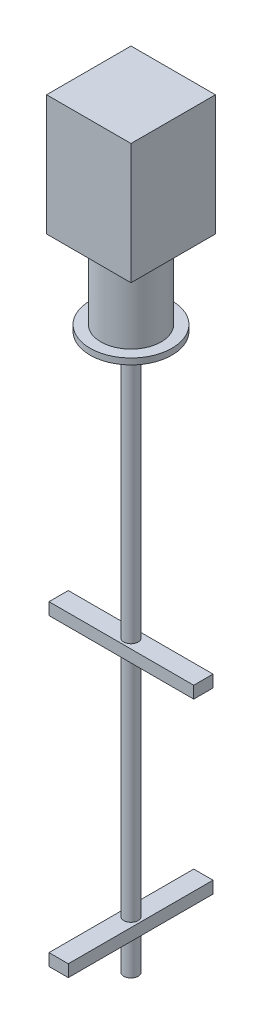
from build123d import *

# Parameters (mm, degrees)
SKETCH1_R           = 170
SKETCH1_R_2         = 100
BOSS_EXTRUDE1_DEPTH = 25
BOSS_EXTRUDE2_START = 25
SKETCH2_R           = 125
BOSS_EXTRUDE2_DEPTH = 325
BOSS_EXTRUDE3_START = 350
SKETCH3_W           = 350
SKETCH3_H           = 350
BOSS_EXTRUDE3_DEPTH = 500
SKETCH4_R           = 30
BOSS_EXTRUDE4_DEPTH = 2300
BOSS_EXTRUDE5_START = -1100
SKETCH5_W           = 600
SKETCH5_H           = 80
BOSS_EXTRUDE5_DEPTH = 50
BOSS_EXTRUDE6_START = -2100
SKETCH6_W           = 80
SKETCH6_H           = 600
BOSS_EXTRUDE6_DEPTH = 50


with BuildPart() as part:
    # Sketch1 → Boss-Extrude1 (new body)
    with BuildSketch(Plane(origin=(0, 0, 0), x_dir=(1, 0, 0), z_dir=(0, 1, 0))):
        with Locations(Location((0, 0, 0), (0, 0, 270))):
            Circle(SKETCH1_R)
        with Locations(Location((0, 0, 0), (0, 0, 270))):
            Circle(SKETCH1_R_2, mode=Mode.SUBTRACT)
    extrude(amount=BOSS_EXTRUDE1_DEPTH)

    # Sketch2 → Boss-Extrude2 (add)
    with BuildSketch(Plane(origin=(0, 0, 0), x_dir=(1, 0, 0), z_dir=(0, 1, 0)).offset(BOSS_EXTRUDE2_START)):
        with Locations(Location((0, 0, 0), (0, 0, 270))):
            Circle(SKETCH2_R)
    extrude(amount=BOSS_EXTRUDE2_DEPTH)

    # Sketch3 → Boss-Extrude3 (add)
    with BuildSketch(Plane(origin=(0, 0, 0), x_dir=(1, 0, 0), z_dir=(0, 1, 0)).offset(BOSS_EXTRUDE3_START)):
        Rectangle(SKETCH3_W, SKETCH3_H)
    extrude(amount=BOSS_EXTRUDE3_DEPTH)


with BuildPart() as body_2:
    # Sketch4 → Boss-Extrude4 (new body)
    with BuildSketch(Plane(origin=(0, 0, 0), x_dir=(1, 0, 0), z_dir=(0, 1, 0))):
        with Locations(Location((0, 0, 0), (0, 0, 270))):
            Circle(SKETCH4_R)
    extrude(amount=-BOSS_EXTRUDE4_DEPTH)

    # Sketch5 → Boss-Extrude5 (add)
    with BuildSketch(Plane(origin=(0, 0, 0), x_dir=(1, 0, 0), z_dir=(0, 1, 0)).offset(BOSS_EXTRUDE5_START)):
        Rectangle(SKETCH5_W, SKETCH5_H)
    extrude(amount=-BOSS_EXTRUDE5_DEPTH)

    # Sketch6 → Boss-Extrude6 (add)
    with BuildSketch(Plane(origin=(0, 0, 0), x_dir=(1, 0, 0), z_dir=(0, 1, 0)).offset(BOSS_EXTRUDE6_START)):
        Rectangle(SKETCH6_W, SKETCH6_H)
    extrude(amount=-BOSS_EXTRUDE6_DEPTH)


solid = Compound([part.part, body_2.part])
